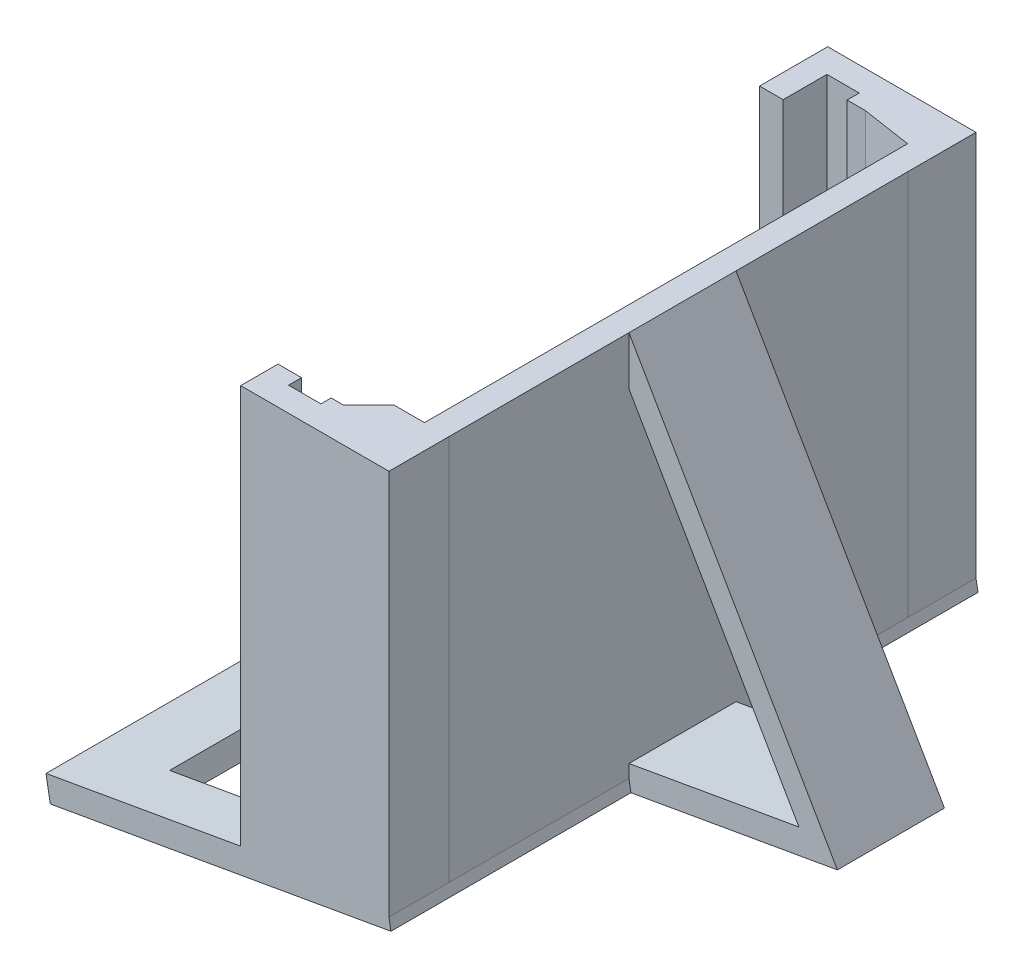
from build123d import *

# Parameters (mm, degrees)
SKETCH1_W           = 38.699948
SKETCH1_H           = 153.19375
BOSS_EXTRUDE1_DEPTH = 0.0254
BOSS_EXTRUDE2_DEPTH = 104.14
SKETCH6_W           = 6.35
SKETCH6_H           = 104.14
BOSS_EXTRUDE3_DEPTH = 119.798010362
BOSS_EXTRUDE7_REACH = 191.252
BOSS_EXTRUDE5_START = -62.626875
BOSS_EXTRUDE5_DEPTH = 27.94
CUT_EXTRUDE1_REACH  = 209.329
SKETCH14_W          = 11.4125
SKETCH14_H          = 19.05
BOSS_EXTRUDE8_REACH = 204.162
SKETCH18_W          = 27.94
SKETCH18_H          = 6.35
SKETCH19_W          = 19.05
SKETCH19_H          = 19.05
CUT_EXTRUDE2_DEPTH  = 208.293560784
SKETCH20_W          = 135.918968774
SKETCH20_H          = 500.058977118
CUT_EXTRUDE3_DEPTH  = 153.162


with BuildPart() as part:
    # Sketch1 → Boss-Extrude1 (new body)
    with BuildSketch(Plane(origin=(0, 0, 0), x_dir=(1, 0, 0), z_dir=(0, 1, 0))):
        with Locations((19.349974, 76.596875)):
            Rectangle(SKETCH1_W, SKETCH1_H)
    extrude(amount=BOSS_EXTRUDE1_DEPTH)

    # Sketch3 → Boss-Extrude2 (add)
    with BuildSketch(Plane(origin=(0, 0.0254, 0), x_dir=(1, 0, 0), z_dir=(0, 1, 0))):
        Polygon((6.15, 146.84375), (14.587499908, 146.84375), (14.587499908, 143.66875), (19.349999908, 143.66875), (32.349999908, 141.684375), (32.349999908, 135.41375), (38.699999908, 135.41375), (38.699999908, 153.19375), (0, 153.19375), (0, 135.41375), (6.15, 135.41375), align=None)
        Polygon((17.762499908, 9.025), (14.587499908, 9.025), (14.587499908, 6.35), (6.15, 6.35), (6.15, 9.74074125), (0, 9.74074125), (0, 0), (38.699921546, 0), (38.699921546, 15.615739638), (24.353239546, 15.615739638), align=None)
    extrude(amount=BOSS_EXTRUDE2_DEPTH)

    # Sketch6 → Boss-Extrude3 (add)
    with BuildSketch(Plane.XY.offset(-135.41375)):
        with Locations((35.524999908, 52.0954)):
            Rectangle(SKETCH6_W, SKETCH6_H)
    extrude(amount=BOSS_EXTRUDE3_DEPTH)

    # Boss-Extrude7: up to this face of the body (flat: up to its plane)
    boss_extrude7_end = Plane(part.part.faces().sort_by_distance((19.349999948, 52.082700017, -153.19375))[0])
    # Sketch15 → Boss-Extrude7 (add, up to the picked face)
    with BuildSketch(Plane.XY, mode=Mode.PRIVATE) as boss_extrude7_sk1:
        Polygon((-50.8, -8.87193717), (-49.680323673, -15.22193717), (39.219676327, 0.453531415), (38.1, 6.803531415), align=None)
    boss_extrude7_tool1 = split(extrude(boss_extrude7_sk1.sketch, amount=-BOSS_EXTRUDE7_REACH, mode=Mode.PRIVATE), bisect_by=boss_extrude7_end, keep=Keep.BOTH, mode=Mode.PRIVATE)
    add(boss_extrude7_tool1.solids().sort_by(Axis((-5.790162, -4.209203, 0), (0, 0, -1)))[0])

    # Sketch11 → Boss-Extrude5 (add)
    with BuildSketch(Plane(origin=(0, 0, -153.19375), x_dir=(-1, 0, 0), z_dir=(0, 0, -1)).offset(BOSS_EXTRUDE5_START)):
        Polygon((-38.699948, 104.1654), (-93.093533667, 9.952946019), (-86.438666859, 8.779513448), (-38.699948, 91.4654), align=None)
    extrude(amount=-BOSS_EXTRUDE5_DEPTH)

    # Sketch14 → Cut-Extrude1 (cut, up to next)
    with BuildSketch(Plane(origin=(0, 0, -153.19375), x_dir=(-1, 0, 0), z_dir=(0, 0, -1)), mode=Mode.PRIVATE) as cut_extrude1_sk1:
        with Locations((-20.293749908, 49.53)):
            Rectangle(SKETCH14_W, SKETCH14_H)
    cut_extrude1_tool1 = extrude(cut_extrude1_sk1.sketch, amount=-CUT_EXTRUDE1_REACH, mode=Mode.PRIVATE) & part.part
    add(cut_extrude1_tool1.solids().sort_by_distance((20.29375, 49.53, -153.19375))[0], mode=Mode.SUBTRACT)

    # Boss-Extrude8: up to this plane
    boss_extrude8_end = Plane(origin=(38.699948, 91.4654, -62.626875), z_dir=(0.8660254037844379, 0.5000000000000011, 0))
    # Sketch18 → Boss-Extrude8 (add, up to the surface)
    with BuildSketch(Plane(origin=(38.114616821, 6.720635305, 0), x_dir=(0, 0, -1), z_dir=(0.9848077530122079, 0.17364817766693177, 0)), mode=Mode.PRIVATE) as boss_extrude8_sk1:
        with Locations((76.596875, -3.188784069)):
            Rectangle(SKETCH18_W, SKETCH18_H)
    boss_extrude8_tool1 = split(extrude(boss_extrude8_sk1.sketch, amount=BOSS_EXTRUDE8_REACH, mode=Mode.PRIVATE), bisect_by=boss_extrude8_end, keep=Keep.BOTH, mode=Mode.PRIVATE)
    add(boss_extrude8_tool1.solids().sort_by_distance((38.668343, 3.580296, -76.596875))[0])

    # Sketch19 → Cut-Extrude2 (cut, through all)
    with BuildSketch(Plane(origin=(-0.014616821, 0.08289611, 0), x_dir=(0.984807753012208, 0.1736481776669311, 0), z_dir=(-0.1736481776669311, 0.984807753012208, 0))):
        with Locations((-22.993829575, 124.61875)):
            Rectangle(SKETCH19_W, SKETCH19_H)
        with Locations((-22.993829575, 99.21875)):
            Rectangle(SKETCH19_W, SKETCH19_H)
        with Locations((-22.993829575, 73.81875)):
            Rectangle(SKETCH19_W, SKETCH19_H)
        with Locations((-22.993829575, 48.41875)):
            Rectangle(SKETCH19_W, SKETCH19_H)
        with Locations((-22.993829575, 23.01875)):
            Rectangle(SKETCH19_W, SKETCH19_H)
    extrude(amount=-CUT_EXTRUDE2_DEPTH, mode=Mode.SUBTRACT)

    # Sketch20 → Cut-Extrude3 (cut)
    with BuildSketch(Plane(origin=(1.105059507, -6.26710389, 0), x_dir=(0.9848077530122079, 0.17364817766693127, 0), z_dir=(0.17364817766693127, -0.9848077530122079, 0))):
        with Locations((20.082569743, -64.610703306)):
            Rectangle(SKETCH20_W, SKETCH20_H)
    extrude(amount=CUT_EXTRUDE3_DEPTH, mode=Mode.SUBTRACT)


solid = part.part
